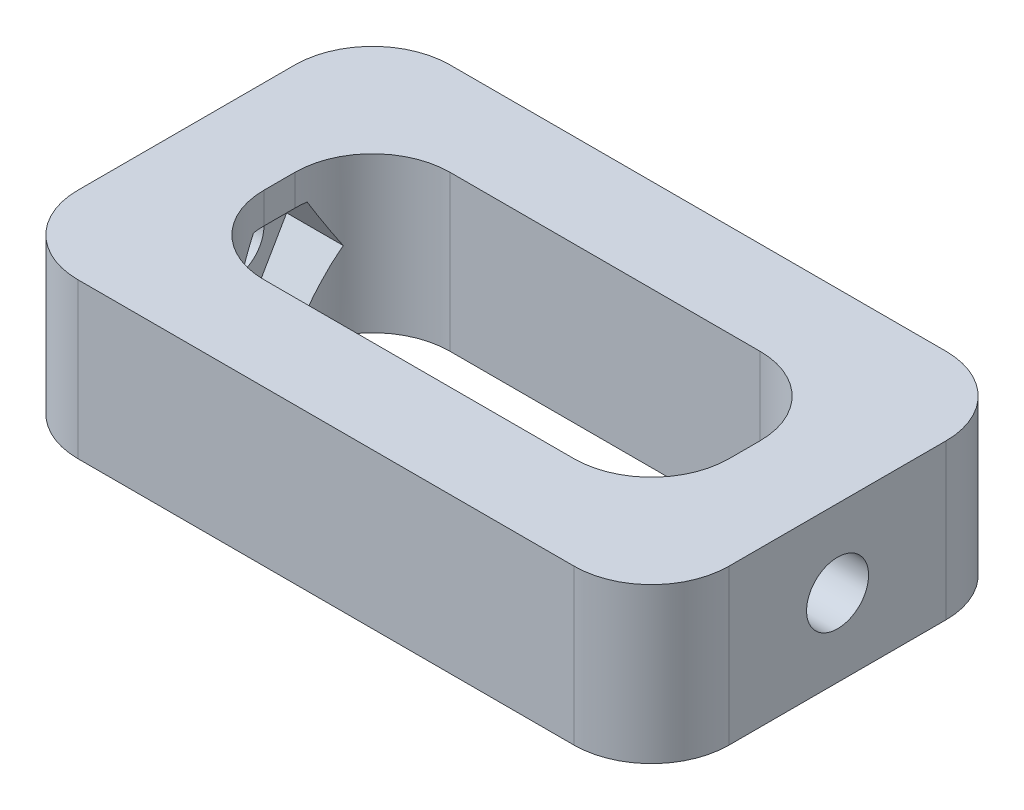
from build123d import *

# Parameters (mm, degrees)
BOSS_EXTRUDE1_DEPTH = 10
CUT_EXTRUDE1_REACH  = 46.811
SKETCH2_R           = 2
CUT_EXTRUDE2_START  = -3
CUT_EXTRUDE2_DEPTH  = 36


with BuildPart() as part:
    # Sketch1 → Boss-Extrude1 (new body)
    with BuildSketch(Plane(origin=(0, 0, 0), x_dir=(1, 0, 0), z_dir=(0, 1, 0))):
        with BuildLine():
            Line((16, -12), (-16, -12))
            ThreePointArc((-16, -12), (-19.535533906, -10.535533906), (-21, -7))
            Line((-21, -7), (-21, 7))
            ThreePointArc((-21, 7), (-19.535533906, 10.535533906), (-16, 12))
            Line((-16, 12), (16, 12))
            ThreePointArc((16, 12), (19.535533906, 10.535533906), (21, 7))
            Line((21, 7), (21, -7))
            ThreePointArc((21, -7), (19.535533906, -10.535533906), (16, -12))
        make_face()
        with BuildLine():
            Line((-10, -6), (10, -6))
            ThreePointArc((10, -6), (13.535533906, -4.535533906), (15, -1))
            Line((15, -1), (15, 1))
            ThreePointArc((15, 1), (13.535533906, 4.535533906), (10, 6))
            Line((10, 6), (-10, 6))
            ThreePointArc((-10, 6), (-13.535533906, 4.535533906), (-15, 1))
            Line((-15, 1), (-15, -1))
            ThreePointArc((-15, -1), (-13.535533906, -4.535533906), (-10, -6))
        make_face(mode=Mode.SUBTRACT)
    extrude(amount=BOSS_EXTRUDE1_DEPTH)

    # Cut-Extrude1: up to this face of the body (flat: up to its plane)
    cut_extrude1_end = Plane(part.part.faces().sort_by_distance((-21, 5, 0))[0])
    # Sketch2 → Cut-Extrude1 (cut, up to the picked face)
    with BuildSketch(Plane(origin=(21, 0, 0), x_dir=(0, 0, -1), z_dir=(1, 0, 0)), mode=Mode.PRIVATE) as cut_extrude1_sk1:
        with Locations((0, 5)):
            Circle(SKETCH2_R)
    cut_extrude1_tool1 = split(extrude(cut_extrude1_sk1.sketch, amount=-CUT_EXTRUDE1_REACH, mode=Mode.PRIVATE), bisect_by=cut_extrude1_end, keep=Keep.BOTH, mode=Mode.PRIVATE)
    add(cut_extrude1_tool1.solids().sort_by(Axis((21, 5, 0), (-1, 0, 0)))[0], mode=Mode.SUBTRACT)

    # Sketch3 → Cut-Extrude2 (cut)
    with BuildSketch(Plane(origin=(-15, 0, 0), x_dir=(0, 0, -1), z_dir=(1, 0, 0)).offset(CUT_EXTRUDE2_START)):
        Polygon((3.464101615, 5), (1.732050808, 8), (-1.732050808, 8), (-3.464101615, 5), (-1.732050808, 2), (1.732050808, 2), align=None)
    extrude(amount=CUT_EXTRUDE2_DEPTH, mode=Mode.SUBTRACT)


solid = part.part
